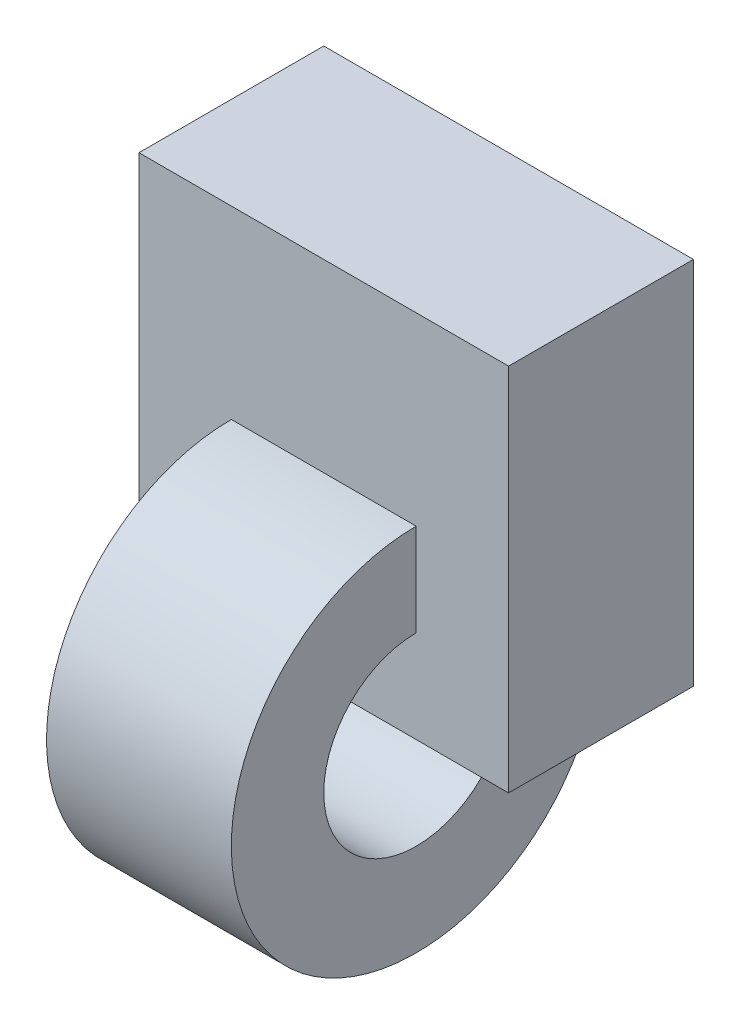
from build123d import *

# Parameters (mm, degrees)
SKETCH_1_W    = 20
SKETCH_1_H    = 20
BASEBOX_DEPTH = 10
SKETCH_2_W    = 10
SKETCH_2_H    = 5


with BuildPart() as part:
    # 草图1 → BaseBox (new body)
    with BuildSketch(Plane.XY):
        with Locations((10, 10)):
            Rectangle(SKETCH_1_W, SKETCH_1_H)
    extrude(amount=BASEBOX_DEPTH)

    # 草图2 → RevolveAxisEdge (revolve)
    with BuildSketch(Plane.XY.offset(10)):
        with Locations((10, 7.5)):
            Rectangle(SKETCH_2_W, SKETCH_2_H)
    revolve(axis=Axis((0, 0, 10), (1, 0, 0)))


solid = part.part
